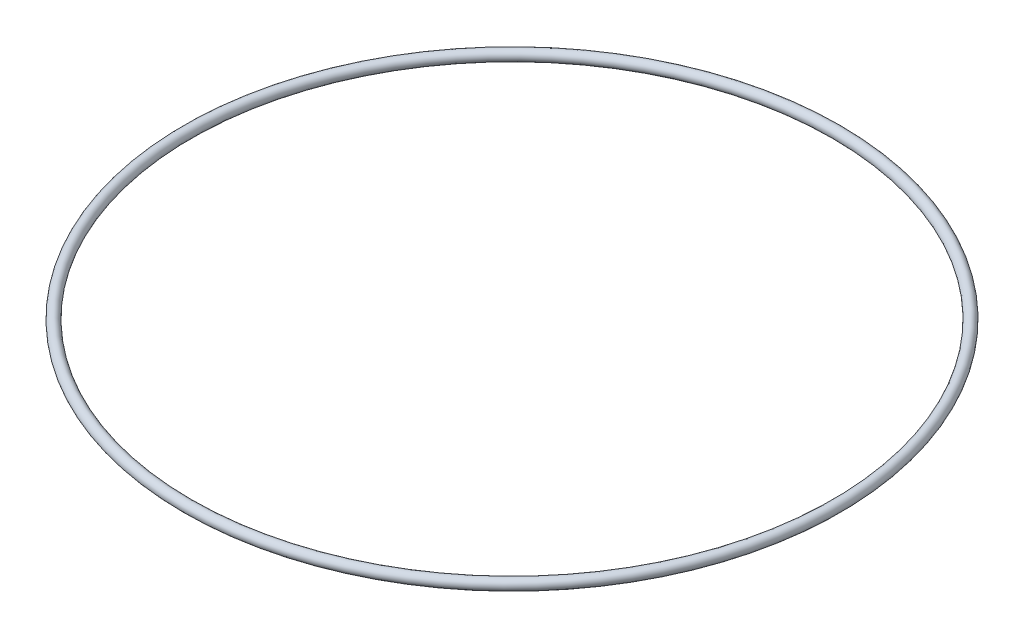
from build123d import *

# Parameters (mm, degrees)
SKETCH1_R = 1.5875


with BuildPart() as part:
    # Sketch1 → Revolve2 (revolve)
    with BuildSketch(Plane.XY, mode=Mode.PRIVATE) as revolve2_sk:
        with Locations((-96.8375, 0)):
            Circle(SKETCH1_R)
    revolve(revolve2_sk.sketch.rotate(Axis((0, 0, 0), (0, 1, 0)), 270), axis=Axis((0, 0, 0), (0, 1, 0)))


solid = part.part
